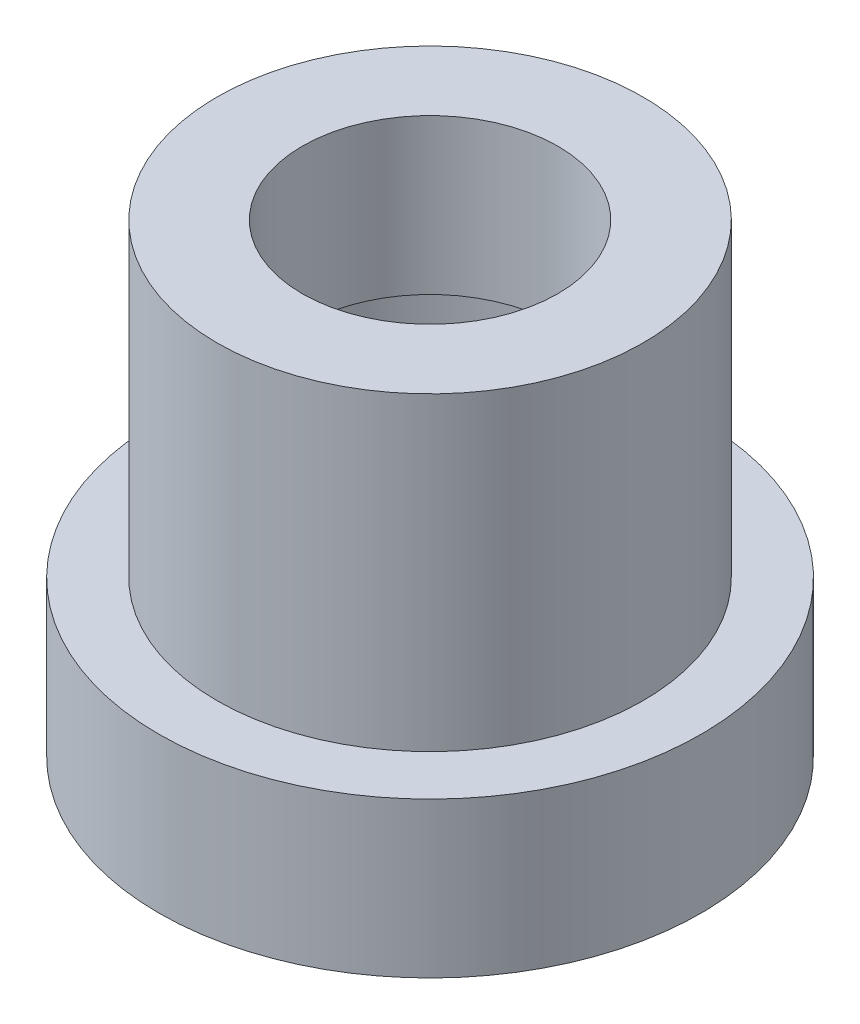
from build123d import *

# Parameters (mm, degrees)
SKETCH3_R           = 3.5
SKETCH3_R_2         = 2.5
BOSS_EXTRUDE3_DEPTH = 2
SKETCH4_R           = 2.75
SKETCH4_R_2         = 1.65
BOSS_EXTRUDE4_DEPTH = 4
SKETCH5_R           = 2.5
CUT_EXTRUDE1_DEPTH  = 2


with BuildPart() as part:
    # Sketch3 → Boss-Extrude3 (new body)
    with BuildSketch(Plane(origin=(0, 0, 0), x_dir=(1, 0, 0), z_dir=(0, 1, 0))):
        with Locations(Location((0, 0, 0), (0, 0, 270))):
            Circle(SKETCH3_R)
        with Locations(Location((0, 0, 0), (0, 0, 270))):
            Circle(SKETCH3_R_2, mode=Mode.SUBTRACT)
    extrude(amount=BOSS_EXTRUDE3_DEPTH)

    # Sketch4 → Boss-Extrude4 (add)
    with BuildSketch(Plane(origin=(0, 2, 0), x_dir=(1, 0, 0), z_dir=(0, 1, 0))):
        with Locations(Location((0, 0, 0), (0, 0, 270))):
            Circle(SKETCH4_R)
        with Locations(Location((0, 0, 0), (0, 0, 270))):
            Circle(SKETCH4_R_2, mode=Mode.SUBTRACT)
    extrude(amount=BOSS_EXTRUDE4_DEPTH)

    # Sketch5 → Cut-Extrude1 (cut)
    with BuildSketch(Plane.XZ.offset(-2)):
        with Locations(Location((0, 0, 0), (0, 0, 270))):
            Circle(SKETCH5_R)
    extrude(amount=-CUT_EXTRUDE1_DEPTH, mode=Mode.SUBTRACT)


solid = part.part
